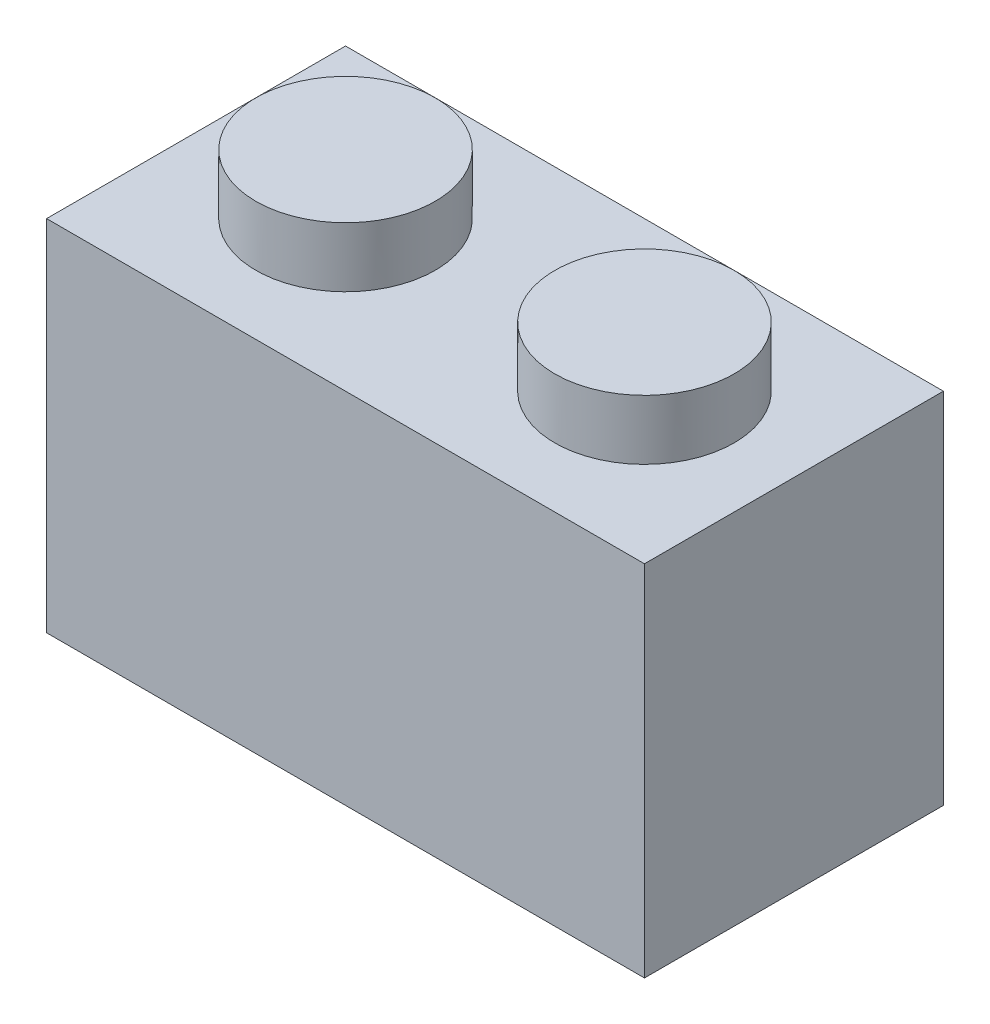
from build123d import *

# Parameters (mm, degrees)
SKETCH1_W            = 16
SKETCH1_H            = 8
BOSS_EXTRUDE1_DEPTH  = 9.6
SKETCH2_R            = 2.4
BOSS_EXTRUDE2_DEPTH  = 1.6
LPATTERN1_COUNT      = 2
LPATTERN1_PITCH      = 8
LPATTERN1_COUNT_DIR2 = 4
LPATTERN1_PITCH_DIR2 = 8
SHELL1_T             = -1.6


with BuildPart() as part:
    # Sketch1 → Boss-Extrude1 (new body)
    with BuildSketch(Plane(origin=(0, 0, 0), x_dir=(1, 0, 0), z_dir=(0, 1, 0))):
        with Locations((8, 4)):
            Rectangle(SKETCH1_W, SKETCH1_H)
    extrude(amount=BOSS_EXTRUDE1_DEPTH)

    # Sketch2 → Boss-Extrude2 (add)
    with BuildSketch(Plane(origin=(0, 9.6, 0), x_dir=(1, 0, 0), z_dir=(0, 1, 0))):
        with Locations(Location((12, 4, 0), (0, 0, 90))):
            Circle(SKETCH2_R)
    boss_extrude2 = extrude(amount=BOSS_EXTRUDE2_DEPTH)

    # LPattern1: Boss-Extrude2 2 × 4, 6 skipped
    with Locations(*[(-i * LPATTERN1_PITCH, 0, -j * LPATTERN1_PITCH_DIR2) for i in range(LPATTERN1_COUNT) for j in range(LPATTERN1_COUNT_DIR2) if (i, j) not in ((0, 0), (0, 1), (0, 2), (0, 3), (1, 1), (1, 2), (1, 3))]):
        add(boss_extrude2)

    # Shell1
    shell1_openings = [part.faces().sort_by_distance(p)[0] for p in [
        (8, 0, -4),
    ]]
    offset(amount=SHELL1_T, openings=shell1_openings, kind=Kind.INTERSECTION)


solid = part.part
